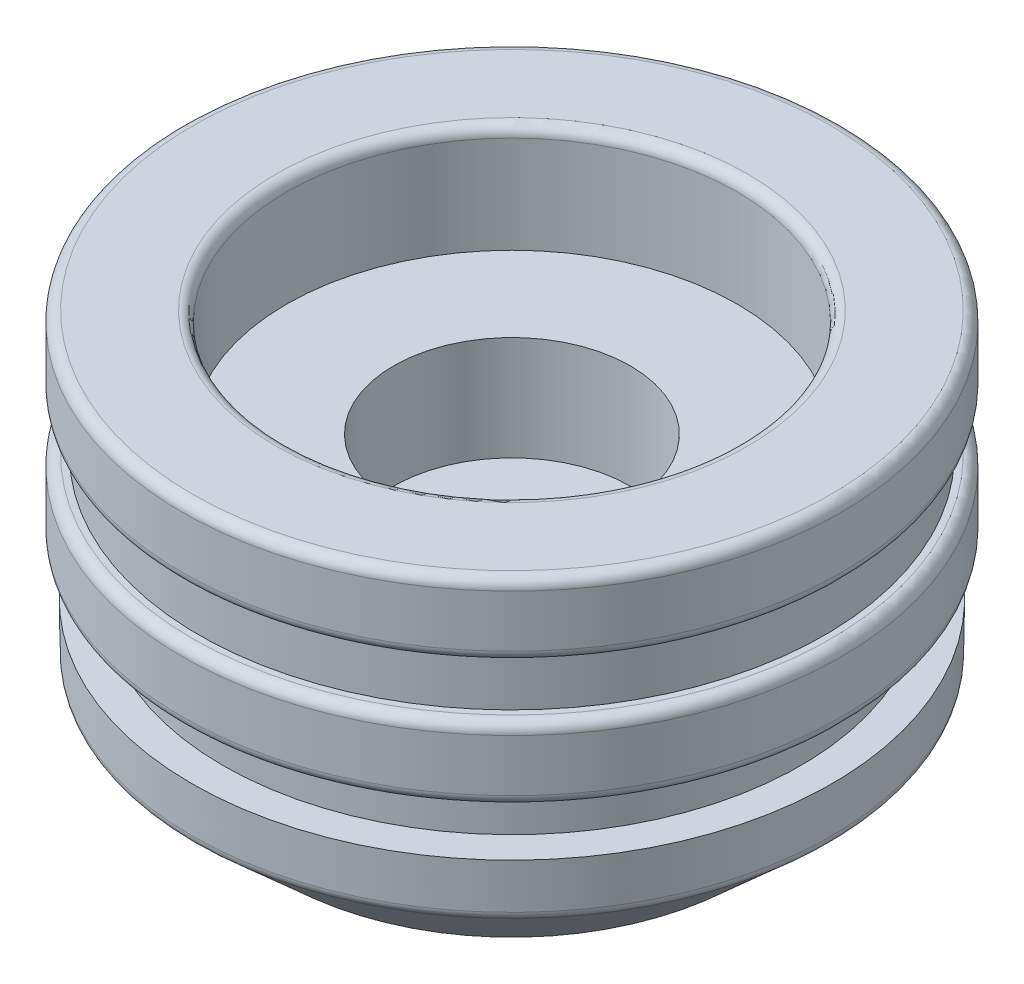
from build123d import *


with BuildPart() as part:
    # Sketch1 → Revolve2 (revolve)
    with BuildSketch(Plane.XY, mode=Mode.PRIVATE) as revolve2_sk:
        with BuildLine():
            Line((-3.445957373, 2.110955011), (-3.445957373, 1.610955011))
            ThreePointArc((-3.445957373, 1.610955011), (-3.475246695, 1.540244333), (-3.545957373, 1.510955011))
            Line((-3.545957373, 1.510955011), (-3.605897774, 1.510955011))
            Line((-3.605897774, 1.510955011), (-3.605897774, 1.010955011))
            Line((-3.605897774, 1.010955011), (-3.545957373, 1.010955011))
            ThreePointArc((-3.545957373, 1.010955011), (-3.475246695, 0.981665689), (-3.445957373, 0.910955011))
            Line((-3.445957373, 0.910955011), (-3.445957373, 0.410955011))
            ThreePointArc((-3.445957373, 0.410955011), (-3.475246695, 0.340244333), (-3.545957373, 0.310955011))
            Line((-3.545957373, 0.310955011), (-3.836719096, 0.310955011))
            Line((-3.836719096, 0.310955011), (-3.836719096, -0.189044989))
            Line((-3.836719096, -0.189044989), (-3.536719096, -0.189044989))
            Line((-3.536719096, -0.189044989), (-3.543008768, -0.6273354))
            ThreePointArc((-3.543008768, -0.6273354), (-3.551962012, -0.667281206), (-3.576171401, -0.700292318))
            Line((-3.576171401, -0.700292318), (-4.397425171, -1.438034543))
            Line((-4.397425171, -1.438034543), (-6.608485699, -1.438034543))
            Line((-6.608485699, -1.438034543), (-6.608485699, 0.179065862))
            Line((-6.608485699, 0.179065862), (-5.471924333, 0.179065862))
            Line((-5.471924333, 0.179065862), (-5.471924333, 1.179065862))
            Line((-5.471924333, 1.179065862), (-4.445957373, 1.179065862))
            Line((-4.445957373, 1.179065862), (-4.445957373, 2.110955011))
            ThreePointArc((-4.445957373, 2.110955011), (-4.416668051, 2.181665689), (-4.345957373, 2.210955011))
            Line((-4.345957373, 2.210955011), (-3.545957373, 2.210955011))
            ThreePointArc((-3.545957373, 2.210955011), (-3.475246695, 2.181665689), (-3.445957373, 2.110955011))
        make_face()
    revolve(revolve2_sk.sketch.rotate(Axis((-6.608485699, -1.438034543, 0), (0, 1, 0)), 90), axis=Axis((-6.608485699, -1.438034543, 0), (0, 1, 0)))


solid = part.part
